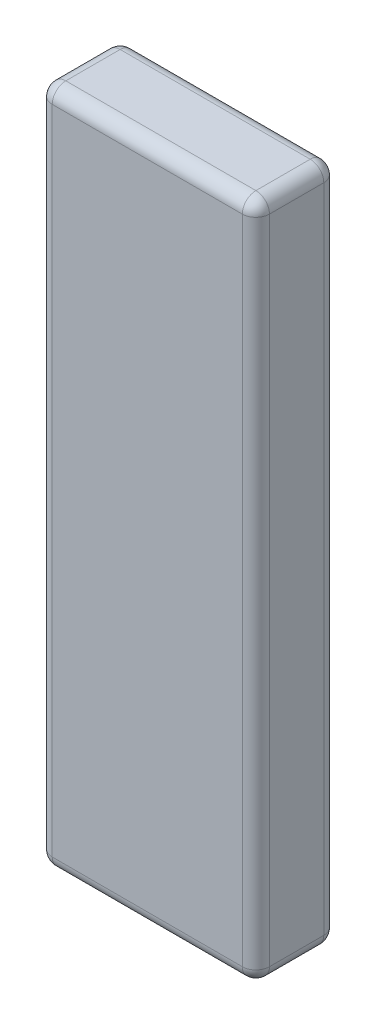
from build123d import *

# Parameters (mm, degrees)
SKETCH1_W           = 20.32
SKETCH1_H           = 63.5
BOSS_EXTRUDE1_DEPTH = 7.62
FILLET1_R           = 1.27


with BuildPart() as part:
    # Sketch1 → Boss-Extrude1 (new body)
    with BuildSketch(Plane.XY):
        Rectangle(SKETCH1_W, SKETCH1_H)
    extrude(amount=BOSS_EXTRUDE1_DEPTH)

    # Fillet1
    fillet1_edges = [part.edges().sort_by_distance(p)[0] for p in [
        (10.16, 0, 7.62),
        (0, 31.75, 7.62),
        (-10.16, 0, 7.62),
        (0, 31.75, 0),
        (10.16, 0, 0),
        (0, -31.75, 0),
        (-10.16, 0, 0),
        (0, -31.75, 7.62),
        (-10.16, 31.75, 3.81),
        (10.16, 31.75, 3.81),
        (10.16, -31.75, 3.81),
        (-10.16, -31.75, 3.81),
    ]]
    fillet(fillet1_edges, radius=FILLET1_R)


solid = part.part
